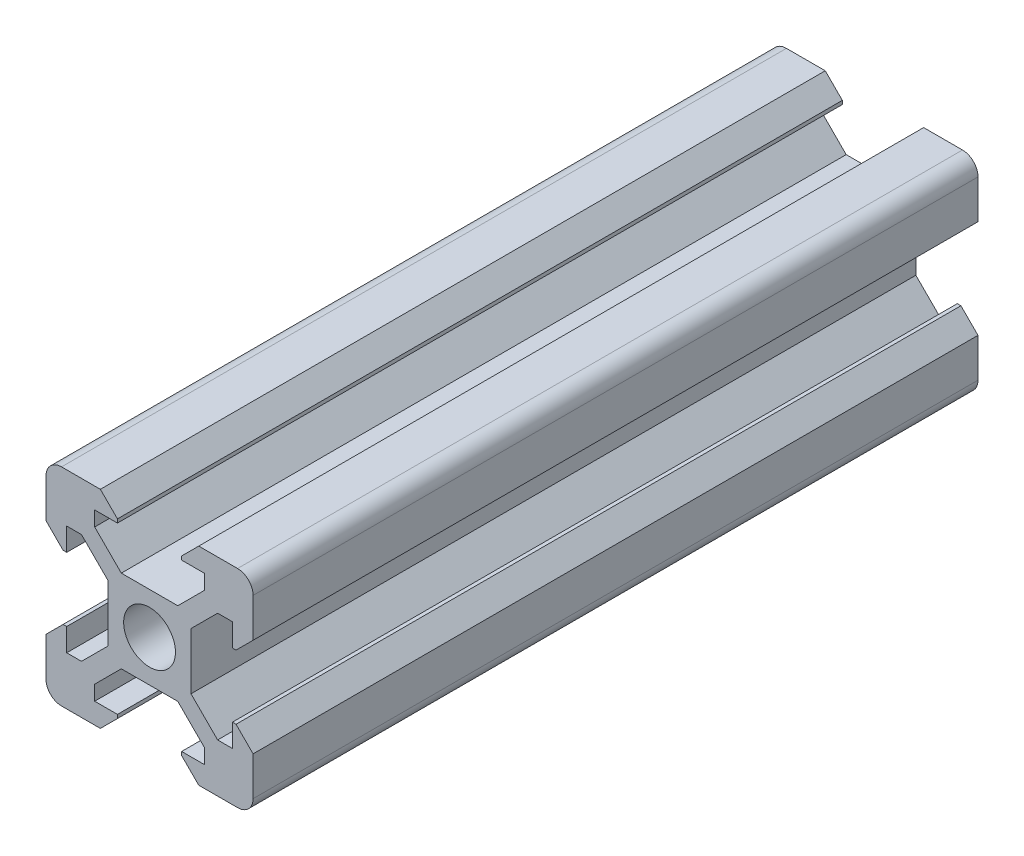
from build123d import *

# Parameters (mm, degrees)
SKETCH2_R           = 2.5
BOSS_EXTRUDE1_DEPTH = 70


with BuildPart() as part:
    # Sketch2 → Boss-Extrude1 (new body)
    with BuildSketch(Plane.XY):
        with BuildLine():
            Line((-4, -2.727207794), (-4, 2.727207794))
            Line((-4, 2.727207794), (-6.572792206, 5.3))
            Line((-6.572792206, 5.3), (-8, 5.3))
            Line((-8, 5.3), (-8, 3.1))
            Line((-8, 3.1), (-8.35, 3.1))
            Line((-8.35, 3.1), (-10, 4.75))
            Line((-10, 4.75), (-10, 8.5))
            ThreePointArc((-10, 8.5), (-9.560660172, 9.560660172), (-8.5, 10))
            Line((-8.5, 10), (-4.75, 10))
            Line((-4.75, 10), (-3.1, 8.35))
            Line((-3.1, 8.35), (-3.1, 8))
            Line((-3.1, 8), (-5.3, 8))
            Line((-5.3, 8), (-5.3, 6.572792206))
            Line((-5.3, 6.572792206), (-2.727207794, 4))
            Line((-2.727207794, 4), (2.727207794, 4))
            Line((2.727207794, 4), (5.3, 6.572792206))
            Line((5.3, 6.572792206), (5.3, 8))
            Line((5.3, 8), (3.1, 8))
            Line((3.1, 8), (3.1, 8.35))
            Line((3.1, 8.35), (4.75, 10))
            Line((4.75, 10), (8.5, 10))
            ThreePointArc((8.5, 10), (9.560660172, 9.560660172), (10, 8.5))
            Line((10, 8.5), (10, 4.75))
            Line((10, 4.75), (8.35, 3.1))
            Line((8.35, 3.1), (8, 3.1))
            Line((8, 3.1), (8, 5.3))
            Line((8, 5.3), (6.572792206, 5.3))
            Line((6.572792206, 5.3), (4, 2.727207794))
            Line((4, 2.727207794), (4, -2.727207794))
            Line((4, -2.727207794), (6.572792206, -5.3))
            Line((6.572792206, -5.3), (8, -5.3))
            Line((8, -5.3), (8, -3.1))
            Line((8, -3.1), (8.35, -3.1))
            Line((8.35, -3.1), (10, -4.75))
            Line((10, -4.75), (10, -8.5))
            ThreePointArc((10, -8.5), (9.560660172, -9.560660172), (8.5, -10))
            Line((8.5, -10), (4.75, -10))
            Line((4.75, -10), (3.1, -8.35))
            Line((3.1, -8.35), (3.1, -8))
            Line((3.1, -8), (5.3, -8))
            Line((5.3, -8), (5.3, -6.572792206))
            Line((5.3, -6.572792206), (2.727207794, -4))
            Line((2.727207794, -4), (-2.727207794, -4))
            Line((-2.727207794, -4), (-5.3, -6.572792206))
            Line((-5.3, -6.572792206), (-5.3, -8))
            Line((-5.3, -8), (-3.1, -8))
            Line((-3.1, -8), (-3.1, -8.35))
            Line((-3.1, -8.35), (-4.75, -10))
            Line((-4.75, -10), (-8.5, -10))
            ThreePointArc((-8.5, -10), (-9.560660172, -9.560660172), (-10, -8.5))
            Line((-10, -8.5), (-10, -4.75))
            Line((-10, -4.75), (-8.35, -3.1))
            Line((-8.35, -3.1), (-8, -3.1))
            Line((-8, -3.1), (-8, -5.3))
            Line((-8, -5.3), (-6.572792206, -5.3))
            Line((-6.572792206, -5.3), (-4, -2.727207794))
        make_face()
        Circle(SKETCH2_R, mode=Mode.SUBTRACT)
    extrude(amount=BOSS_EXTRUDE1_DEPTH)


solid = part.part
